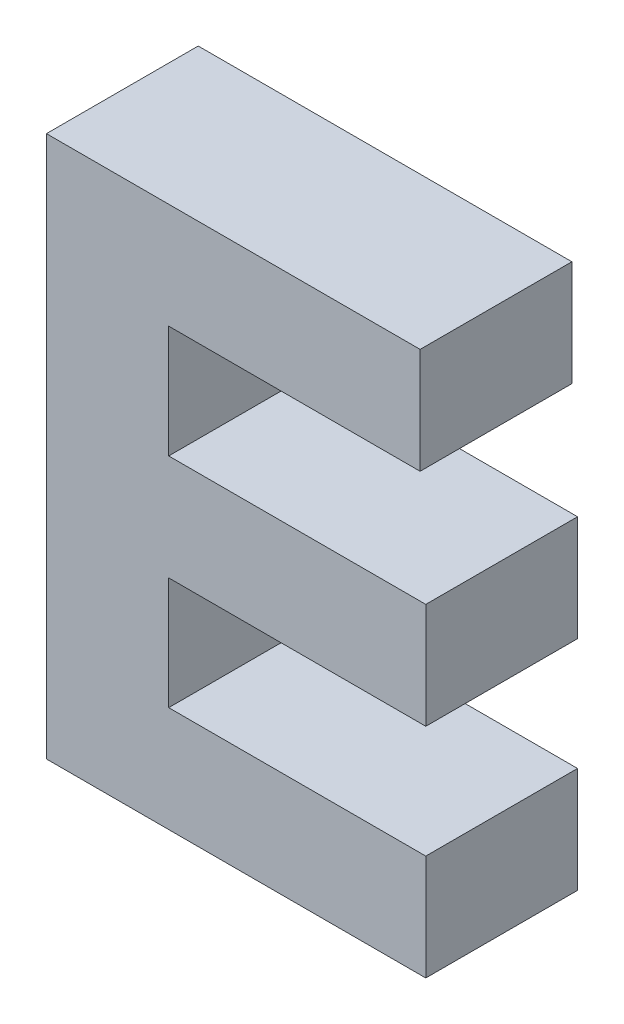
from build123d import *

# Parameters (mm, degrees)
BOSS_EXTRUDE1_DEPTH = 35
SKETCH2_R           = 9.963013746
CUT_EXTRUDE1_DEPTH  = 10


with BuildPart() as part:
    # Sketch1 → Boss-Extrude1 (new body)
    with BuildSketch(Plane.XY):
        Polygon((-16.2157121, 59.829843243), (-102.387525881, 59.829843243), (-102.387525881, -65.063217449), (-14.91334569, -65.063217449), (-14.91334569, -40.713217449), (-74.19334569, -40.713217449), (-74.19334569, -14.793217449), (-14.910053534, -14.793217449), (-14.910053534, 9.556782551), (-74.19334569, 9.556782551), (-74.19334569, 35.480259253), (-16.2157121, 35.480259253), align=None)
    extrude(amount=BOSS_EXTRUDE1_DEPTH)

    # Sketch2 → Cut-Extrude1 (cut)
    with BuildSketch(Plane.XZ.offset(65.063217449)):
        with Locations(Location((-86.628630344, 15.991855585, 0), (0, 0, 270))):
            Circle(SKETCH2_R)
        with Locations(Location((-55.3000658, 15.991855585, 0), (0, 0, 270))):
            Circle(SKETCH2_R)
    extrude(amount=-CUT_EXTRUDE1_DEPTH, mode=Mode.SUBTRACT)


solid = part.part
